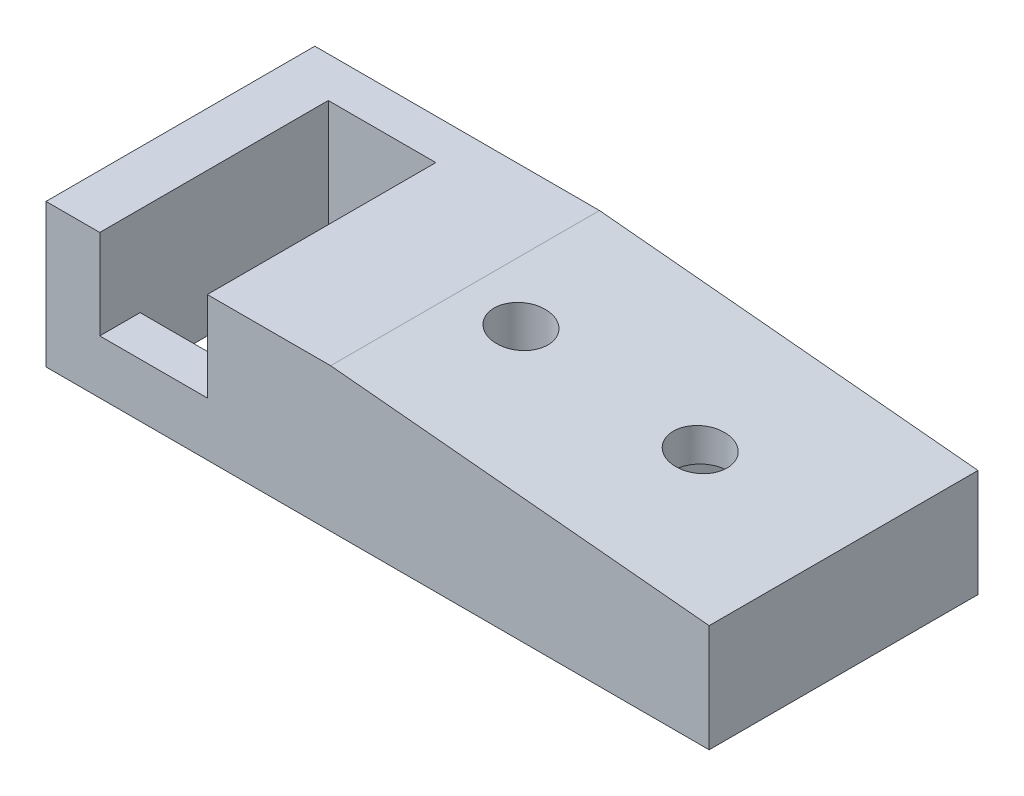
from build123d import *

# Parameters (mm, degrees)
BOSS_EXTRUDE1_DEPTH     = 5
SKETCH2_R               = 1.5
CUT_EXTRUDE1_DEPTH      = 10
SKETCH4_W               = 6
SKETCH4_H               = 10.5
BOSS_EXTRUDE2_DEPTH     = 8
SKETCH3_W               = 5.5
SKETCH3_H               = 3
CUT_EXTRUDE2_DEPTH      = 27.379590534
CUT_EXTRUDE4_DEPTH      = 27.379590534
CUT_EXTRUDE4_DEPTH_BACK = 27.379590534
SKETCH9_W               = 6
SKETCH9_H               = 2.25
CUT_EXTRUDE5_DEPTH      = 5


with BuildPart() as part:
    # Sketch1 → Boss-Extrude1 (new body)
    with BuildSketch(Plane.XY):
        Polygon((0, 8.178190311), (0, 0), (23, 0), (23, 6), align=None)
    extrude(amount=BOSS_EXTRUDE1_DEPTH)

    # Sketch2 → Cut-Extrude1 (cut)
    with BuildSketch(Plane(origin=(0, 0, 0), x_dir=(-1, 0, 0), z_dir=(0, -1, 0))):
        with Locations(Location((-15, -2.5, 0), (0, 0, 90))):
            Circle(SKETCH2_R)
        with Locations(Location((-5, -2.5, 0), (0, 0, 90))):
            Circle(SKETCH2_R)
    extrude(amount=-CUT_EXTRUDE1_DEPTH, mode=Mode.SUBTRACT)

    # Sketch4 → Boss-Extrude2 (add)
    with BuildSketch(Plane(origin=(0, 0, 0), x_dir=(-1, 0, 0), z_dir=(0, -1, 0))):
        Polygon((0, -5), (-23, -5), (-23, -10), (14, -10), (14, 5), (-23, 5), (-23, 0), (0, 0), align=None)
        with Locations((8, -2.5)):
            Rectangle(SKETCH4_W, SKETCH4_H, mode=Mode.SUBTRACT)
    extrude(amount=-BOSS_EXTRUDE2_DEPTH)

    # Sketch3 → Cut-Extrude2 (cut, through all)
    with BuildSketch(Plane.XY.offset(5)):
        with Locations((5, 3.5)):
            Rectangle(SKETCH3_W, SKETCH3_H)
        with Locations((15, 3.5)):
            Rectangle(SKETCH3_W, SKETCH3_H)
    extrude(amount=-CUT_EXTRUDE2_DEPTH, mode=Mode.SUBTRACT)

    # Sketch5 → Cut-Extrude4 (cut, two sides: drawn at the far end of the back side and taken through both)
    with BuildSketch(Plane.XY.offset(5).offset(-CUT_EXTRUDE4_DEPTH_BACK)):
        Polygon((23, 8), (1.881551454, 8), (23, 6), align=None)
        Polygon((1.881551454, 8), (0, 8.178190311), (0, 8), align=None)
    extrude(amount=CUT_EXTRUDE4_DEPTH + CUT_EXTRUDE4_DEPTH_BACK, mode=Mode.SUBTRACT)

    # Sketch9 → Cut-Extrude5 (cut)
    with BuildSketch(Plane(origin=(0, 8, 0), x_dir=(1, 0, 0), z_dir=(0, 1, 0))):
        with Locations((-8, -8.875)):
            Rectangle(SKETCH9_W, SKETCH9_H)
    extrude(amount=-CUT_EXTRUDE5_DEPTH, mode=Mode.SUBTRACT)


solid = part.part
